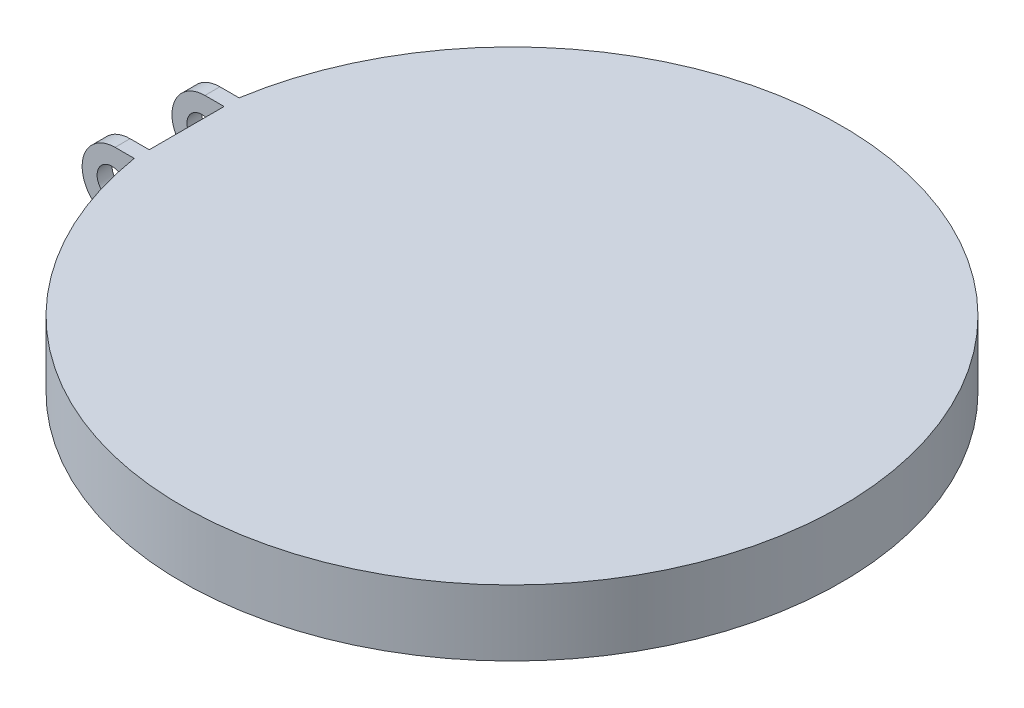
from build123d import *

# Parameters (mm, degrees)
SKETCH3_R           = 1.27
BOSS_EXTRUDE1_DEPTH = 4.445
SKETCH4_W           = 4.419845581
SKETCH4_H           = 6.35
CUT_EXTRUDE1_DEPTH  = 5.588


with BuildPart() as part:
    # Sketch2 → Revolve1 (revolve)
    with BuildSketch(Plane.XY):
        Polygon((0, 0), (0, 5.588), (27.94, 5.588), (27.94, 0), (24.638, 0), (24.638, -1.27), (23.368, -1.27), (23.368, 0), align=None)
    revolve(axis=Axis((0, -1000, 0), (0, 1, 0)))

    # Sketch3 → Boss-Extrude1 (add, symmetric)
    with BuildSketch(Plane.XY):
        with BuildLine():
            Line((-29.21, 0), (-27.305, 0))
            Line((-27.305, 0), (-27.305, 5.588))
            Line((-27.305, 5.588), (-29.21, 5.588))
            ThreePointArc((-29.21, 5.588), (-32.004, 2.794), (-29.21, 0))
        make_face()
        with Locations((-29.464, 2.794)):
            Circle(SKETCH3_R, mode=Mode.SUBTRACT)
    extrude(amount=BOSS_EXTRUDE1_DEPTH, both=True)

    # Sketch4 → Cut-Extrude1 (cut)
    with BuildSketch(Plane(origin=(0, 5.588, 0), x_dir=(1, 0, 0), z_dir=(0, 1, 0))):
        with Locations((-29.79407721, 0)):
            Rectangle(SKETCH4_W, SKETCH4_H)
    extrude(amount=-CUT_EXTRUDE1_DEPTH, mode=Mode.SUBTRACT)


solid = part.part
